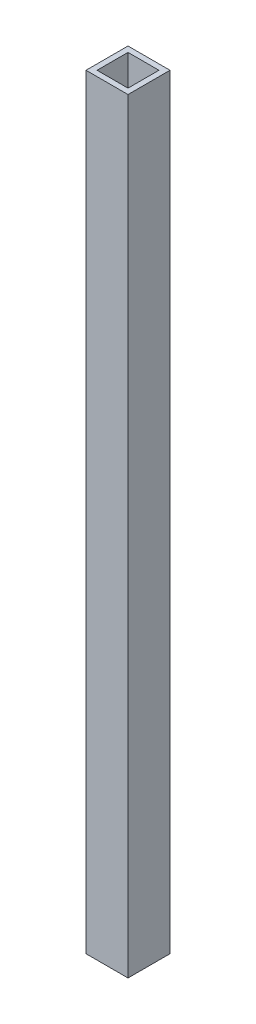
from build123d import *

# Parameters (mm, degrees)
SKETCH1_W           = 38
SKETCH1_H           = 38
SKETCH1_W_2         = 28
SKETCH1_H_2         = 28
BOSS_EXTRUDE1_DEPTH = 692


with BuildPart() as part:
    # Sketch1 → Boss-Extrude1 (new body)
    with BuildSketch(Plane(origin=(0, 0, 0), x_dir=(1, 0, 0), z_dir=(0, 1, 0))):
        with Locations((19, 19)):
            Rectangle(SKETCH1_W, SKETCH1_H)
        with Locations((19, 19)):
            Rectangle(SKETCH1_W_2, SKETCH1_H_2, mode=Mode.SUBTRACT)
    extrude(amount=BOSS_EXTRUDE1_DEPTH)


solid = part.part
